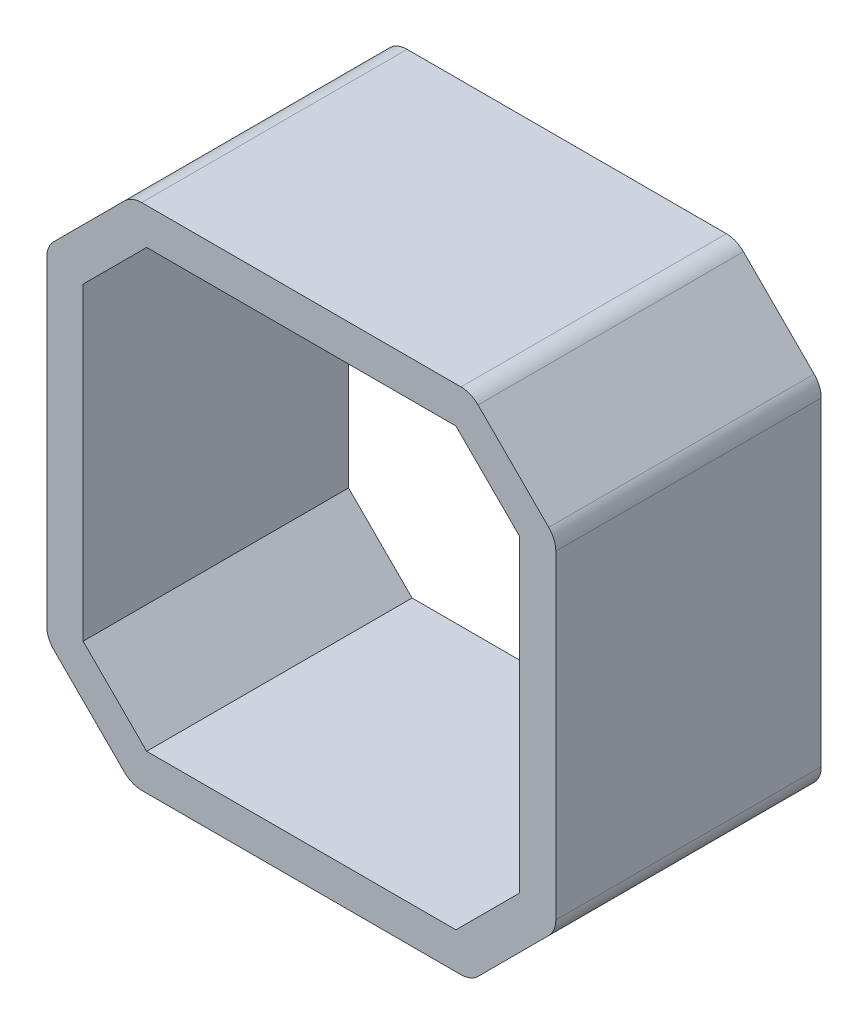
from build123d import *

# Parameters (mm, degrees)
SKETCH1_W           = 42
SKETCH1_H           = 42
BOSS_EXTRUDE1_DEPTH = 10.95
CUT_EXTRUDE1_REACH  = 38.9
FILLET1_R           = 2
CUT_EXTRUDE2_DEPTH  = 21.9


with BuildPart() as part:
    # Sketch1 → Boss-Extrude1 (new, symmetric)
    with BuildSketch(Plane.XY):
        Rectangle(SKETCH1_W, SKETCH1_H)
    extrude(amount=BOSS_EXTRUDE1_DEPTH, both=True)

    # Sketch2 → Cut-Extrude1 (cut, up to next)
    with BuildSketch(Plane.XY.offset(10.95), mode=Mode.PRIVATE) as cut_extrude1_sk1:
        Polygon((-21, 21), (-21, 14), (-14, 21), align=None)
    cut_extrude1_tool1 = extrude(cut_extrude1_sk1.sketch, amount=-CUT_EXTRUDE1_REACH, mode=Mode.PRIVATE) & part.part
    # Sketch2 → Cut-Extrude1 (cut, up to next)
    with BuildSketch(Plane.XY.offset(10.95), mode=Mode.PRIVATE) as cut_extrude1_sk2:
        Polygon((-21, -14), (-14, -21), (-21, -21), align=None)
    cut_extrude1_tool2 = extrude(cut_extrude1_sk2.sketch, amount=-CUT_EXTRUDE1_REACH, mode=Mode.PRIVATE) & part.part
    # Sketch2 → Cut-Extrude1 (cut, up to next)
    with BuildSketch(Plane.XY.offset(10.95), mode=Mode.PRIVATE) as cut_extrude1_sk3:
        Polygon((21, -21), (21, -14), (14, -21), align=None)
    cut_extrude1_tool3 = extrude(cut_extrude1_sk3.sketch, amount=-CUT_EXTRUDE1_REACH, mode=Mode.PRIVATE) & part.part
    # Sketch2 → Cut-Extrude1 (cut, up to next)
    with BuildSketch(Plane.XY.offset(10.95), mode=Mode.PRIVATE) as cut_extrude1_sk4:
        Polygon((21, 14), (14, 21), (21, 21), align=None)
    cut_extrude1_tool4 = extrude(cut_extrude1_sk4.sketch, amount=-CUT_EXTRUDE1_REACH, mode=Mode.PRIVATE) & part.part
    add(cut_extrude1_tool1.solids().sort_by_distance((-18.666667, 18.666667, 10.95))[0], mode=Mode.SUBTRACT)
    add(cut_extrude1_tool2.solids().sort_by_distance((-18.666667, -18.666667, 10.95))[0], mode=Mode.SUBTRACT)
    add(cut_extrude1_tool3.solids().sort_by_distance((18.666667, -18.666667, 10.95))[0], mode=Mode.SUBTRACT)
    add(cut_extrude1_tool4.solids().sort_by_distance((18.666667, 18.666667, 10.95))[0], mode=Mode.SUBTRACT)

    # Fillet1
    fillet1_edges = [part.edges().sort_by_distance(p)[0] for p in [
        (21, 14, 0),
        (14, 21, 0),
        (14, -21, 0),
        (21, -14, 0),
        (-21, -14, 0),
        (-14, -21, 0),
        (-14, 21, 0),
        (-21, 14, 0),
    ]]
    fillet(fillet1_edges, radius=FILLET1_R)

    # 3DSketch1 → Cut-Extrude2 (cut)
    with BuildSketch(Plane(origin=(12.757359313, -18, 10.95), x_dir=(-0.5782394408510358, 0.8158671148197367, 0), z_dir=(0, 0, 1))):
        Polygon((0, 0), (1.245796512, -7.308799751), (22.062416383, -22.062416383), (29.371216134, -20.816619871), (44.124832765, 0), (42.879036253, 7.308799751), (22.062416383, 22.062416383), (14.753616632, 20.816619871), align=None)
    extrude(amount=-CUT_EXTRUDE2_DEPTH, mode=Mode.SUBTRACT)


solid = part.part
